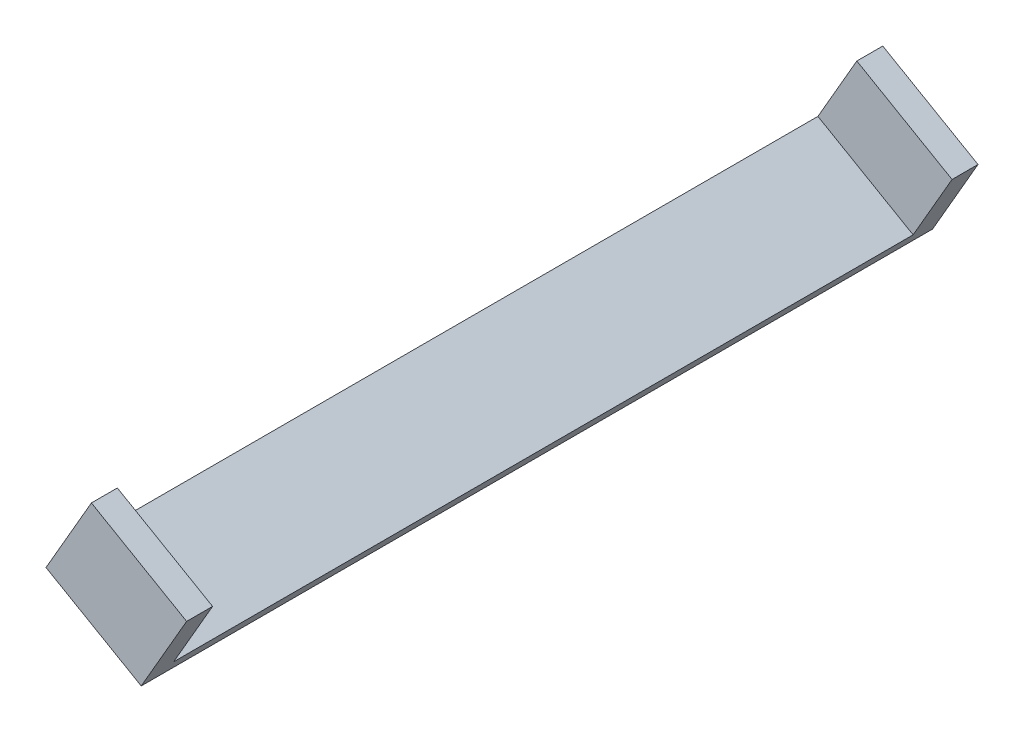
from build123d import *

# Parameters (mm, degrees)
BOSS_EXTRUDE1_DEPTH = 1220
SKETCH4_W           = 169.510039034
SKETCH4_H           = 40
BOSS_EXTRUDE3_DEPTH = 120


with BuildPart() as part:
    # Sketch1 → Boss-Extrude1 (new body)
    with BuildSketch(Plane.XY):
        Polygon((0, 146.8), (10, 164.120508076), (-136.8, 248.875527593), (-146.8, 231.555019517), align=None)
    extrude(amount=BOSS_EXTRUDE1_DEPTH)

    # Sketch4 → Boss-Extrude3 (add)
    with BuildSketch(Plane(origin=(73.566264638, 127.420508076, 0), x_dir=(0.86602540378444, -0.4999999999999976, 0), z_dir=(0.4999999999999976, 0.86602540378444, 0))):
        with Locations((-158.155019517, -1200)):
            Rectangle(SKETCH4_W, SKETCH4_H)
        with Locations((-158.155019517, -20)):
            Rectangle(SKETCH4_W, SKETCH4_H)
    extrude(amount=BOSS_EXTRUDE3_DEPTH)


solid = part.part
